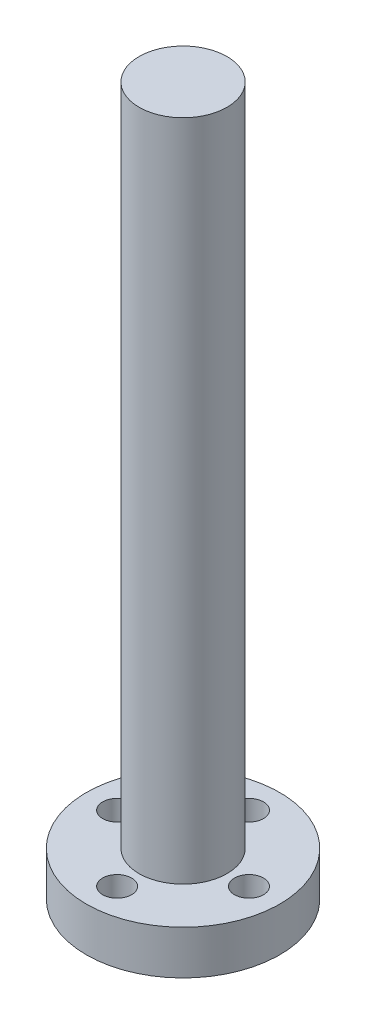
from build123d import *

# Parameters (mm, degrees)
SKETCH1_R                                 = 10
OUTPUT_SHAFT_20MM_DEPTH                   = 161
SKETCH2_R                                 = 22
SKETCH2_R_2                               = 3.3
OUTPUT_LOWER_FLANGE_WITH_BOLT_HOLES_DEPTH = 10


with BuildPart() as part:
    # Sketch1 → Output_Shaft_20mm (new body)
    with BuildSketch(Plane(origin=(0, 0, 0), x_dir=(1, 0, 0), z_dir=(0, 1, 0))):
        with Locations(Location((0, 0, 0), (0, 0, 270))):
            Circle(SKETCH1_R)
    extrude(amount=OUTPUT_SHAFT_20MM_DEPTH)

    # Sketch2 → Output_Lower_Flange_With_Bolt_Holes (add)
    with BuildSketch(Plane(origin=(0, 0, 0), x_dir=(1, 0, 0), z_dir=(0, 1, 0))):
        with Locations(Location((0, 0, 0), (0, 0, 270))):
            Circle(SKETCH2_R)
        with Locations(Location((-15, 0, 0), (0, 0, 270))):
            Circle(SKETCH2_R_2, mode=Mode.SUBTRACT)
        with Locations(Location((15, 0, 0), (0, 0, 270))):
            Circle(SKETCH2_R_2, mode=Mode.SUBTRACT)
        with Locations(Location((0, -15, 0), (0, 0, 270))):
            Circle(SKETCH2_R_2, mode=Mode.SUBTRACT)
        with Locations(Location((0, 15, 0), (0, 0, 270))):
            Circle(SKETCH2_R_2, mode=Mode.SUBTRACT)
    extrude(amount=OUTPUT_LOWER_FLANGE_WITH_BOLT_HOLES_DEPTH)


solid = part.part
